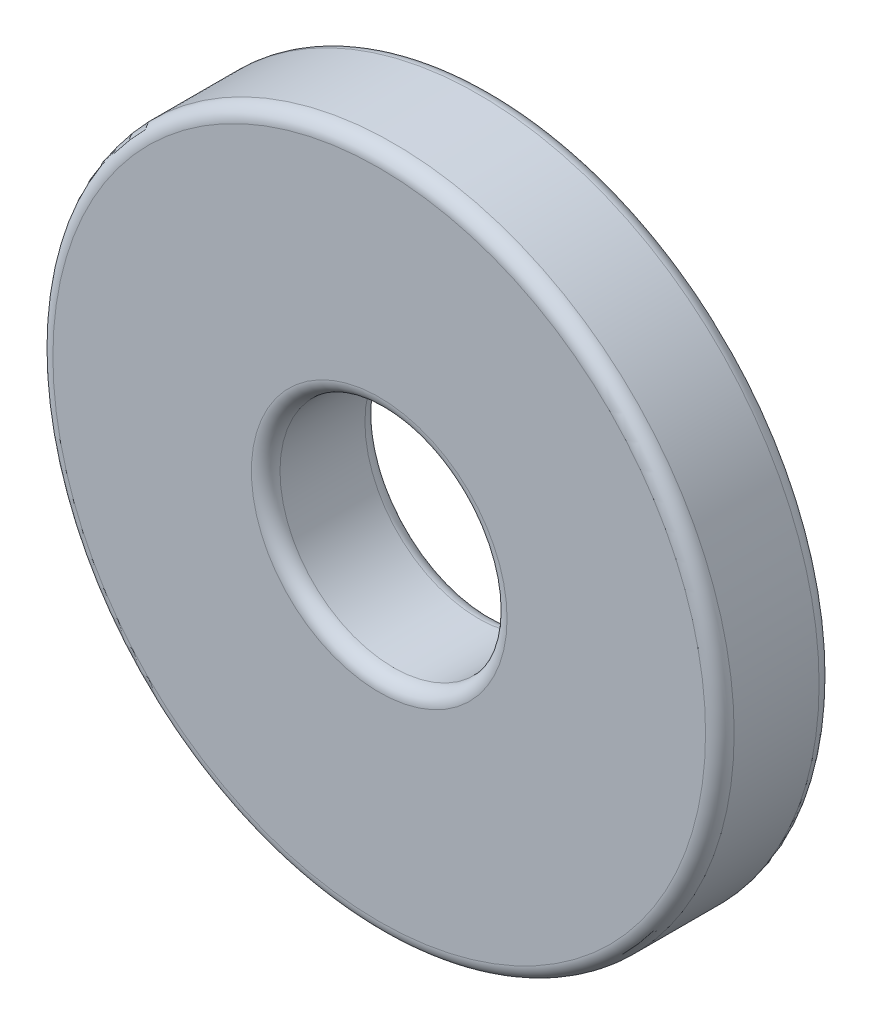
from build123d import *

# Parameters (mm, degrees)
SKETCH1_R           = 4.7625
BOSS_EXTRUDE1_DEPTH = 1.5875
SKETCH2_R           = 1.5875
CUT_EXTRUDE1_DEPTH  = 74.611450938
FILLET1_R           = 0.2
FILLET2_R           = 0.2


with BuildPart() as part:
    # Sketch1 → Boss-Extrude1 (new body)
    with BuildSketch(Plane.XY):
        with Locations((68.398246491, 3.214386977)):
            Circle(SKETCH1_R)
    extrude(amount=BOSS_EXTRUDE1_DEPTH)

    # Sketch2 → Cut-Extrude1 (cut, through all)
    with BuildSketch(Plane(origin=(0, 0, 0), x_dir=(-1, 0, 0), z_dir=(0, 0, -1))):
        with Locations((-68.398246491, 3.214386977)):
            Circle(SKETCH2_R)
    extrude(amount=-CUT_EXTRUDE1_DEPTH, mode=Mode.SUBTRACT)

    # Fillet1
    fillet1_edges = [part.edges().sort_by_distance(p)[0] for p in [
        (63.635746491, 3.214386977, 1.5875),
        (69.985746491, 3.214386977, 1.5875),
        (69.985746491, 3.214386977, 0),
    ]]
    fillet(fillet1_edges, radius=FILLET1_R)

    # Fillet2
    fillet2_edges = [part.edges().sort_by_distance(p)[0] for p in [
        (63.635746491, 3.214386977, 0),
    ]]
    fillet(fillet2_edges, radius=FILLET2_R)


solid = part.part
